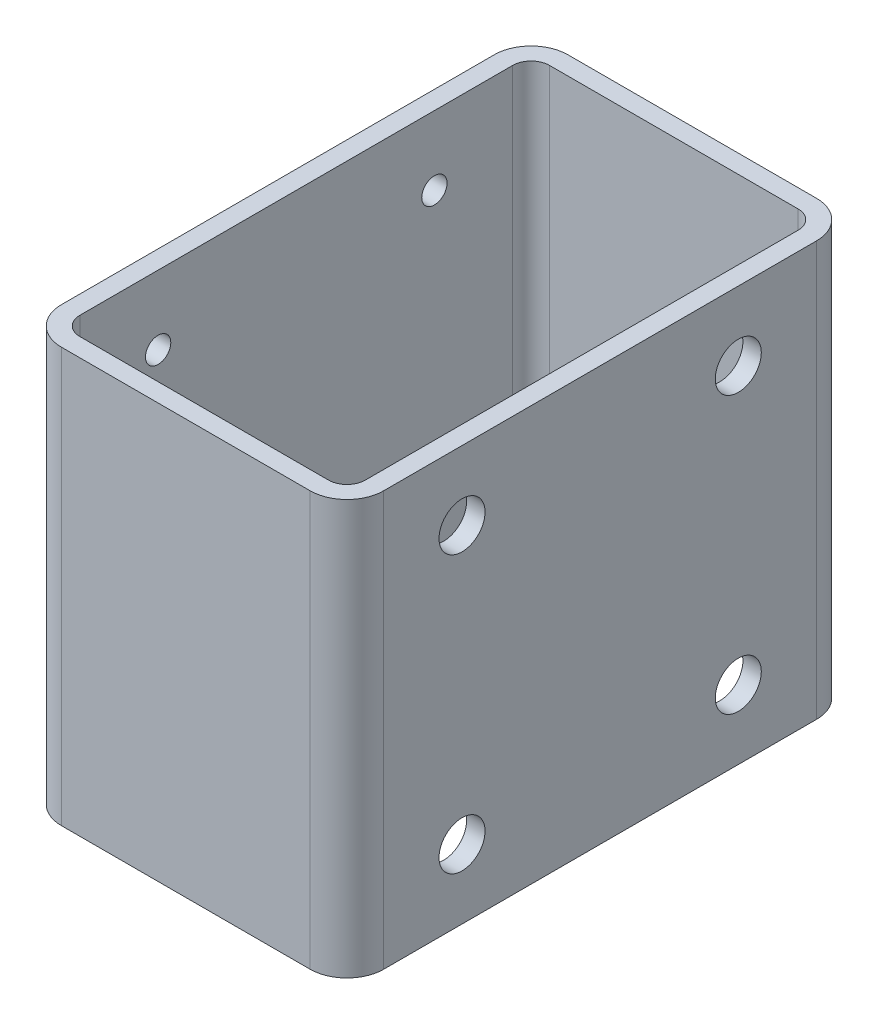
from build123d import *

# Parameters (mm, degrees)
TUBE_RECTANGULAR_220_X_140_X_8_0_1_DEPTH = 180
SKETCH_5_R                               = 5.5
CUT_EXTRUDE_1_DEPTH                      = 10
SKETCH_6_R                               = 10
CUT_EXTRUDE_2_DEPTH                      = 10


with BuildPart() as part:
    # Sketch1 → Tube (rectangular) 220 X 140 X 8.0(1) (new body)
    with BuildSketch(Plane(origin=(0, 0, 0), x_dir=(-1, 0, 0), z_dir=(0, 1, 0))):
        with BuildLine():
            Line((-54, -110), (54, -110))
            ThreePointArc((54, -110), (65.313708499, -105.313708499), (70, -94))
            Line((70, -94), (70, 94))
            ThreePointArc((70, 94), (65.313708499, 105.313708499), (54, 110))
            Line((54, 110), (-54, 110))
            ThreePointArc((-54, 110), (-65.313708499, 105.313708499), (-70, 94))
            Line((-70, 94), (-70, -94))
            ThreePointArc((-70, -94), (-65.313708499, -105.313708499), (-54, -110))
        make_face()
        with BuildLine():
            Line((-54, -102), (54, -102))
            ThreePointArc((54, -102), (59.656854249, -99.656854249), (62, -94))
            Line((62, -94), (62, 94))
            ThreePointArc((62, 94), (59.656854249, 99.656854249), (54, 102))
            Line((54, 102), (-54, 102))
            ThreePointArc((-54, 102), (-59.656854249, 99.656854249), (-62, 94))
            Line((-62, 94), (-62, -94))
            ThreePointArc((-62, -94), (-59.656854249, -99.656854249), (-54, -102))
        make_face(mode=Mode.SUBTRACT)
    extrude(amount=TUBE_RECTANGULAR_220_X_140_X_8_0_1_DEPTH)

    # 草图5 → 切除-拉伸1 (cut)
    with BuildSketch(Plane.ZY.offset(70)):
        with Locations((-60, 30)):
            Circle(SKETCH_5_R)
        with Locations((60, 30)):
            Circle(SKETCH_5_R)
        with Locations((-60, 150)):
            Circle(SKETCH_5_R)
        with Locations((60, 150)):
            Circle(SKETCH_5_R)
    extrude(amount=-CUT_EXTRUDE_1_DEPTH, mode=Mode.SUBTRACT)

    # 草图6 → 切除-拉伸2 (cut)
    with BuildSketch(Plane(origin=(70, 0, 0), x_dir=(0, 0, -1), z_dir=(1, 0, 0))):
        with Locations((-60, 150)):
            Circle(SKETCH_6_R)
        with Locations((60, 150)):
            Circle(SKETCH_6_R)
        with Locations((-60, 30)):
            Circle(SKETCH_6_R)
        with Locations((60, 30)):
            Circle(SKETCH_6_R)
    extrude(amount=-CUT_EXTRUDE_2_DEPTH, mode=Mode.SUBTRACT)


solid = part.part
